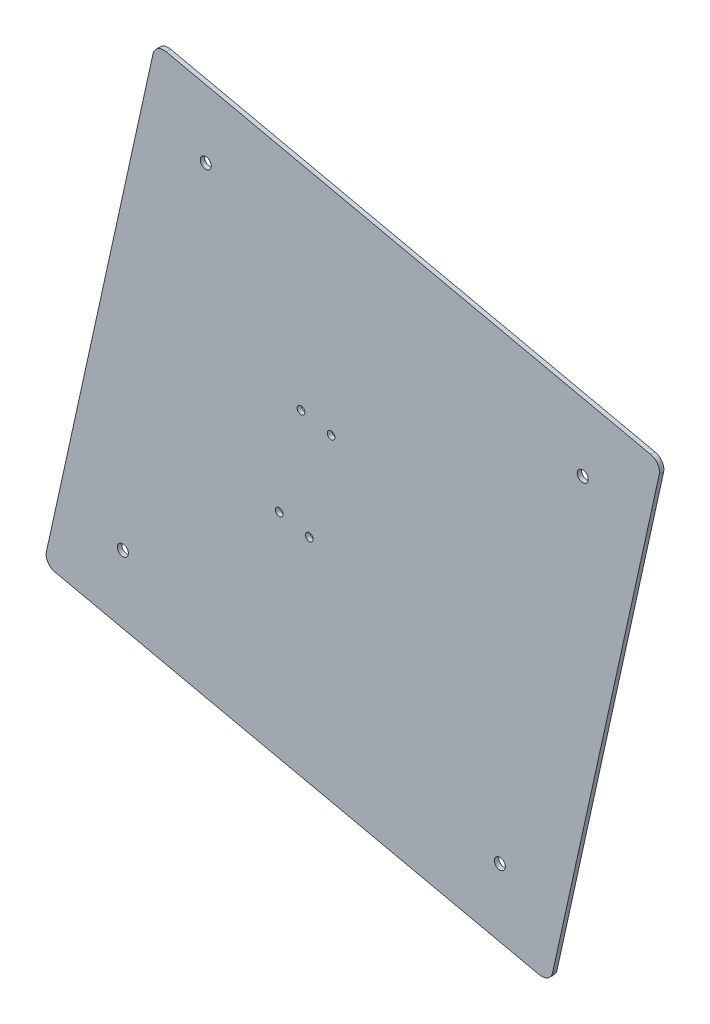
from build123d import *

# Parameters (mm, degrees)
ESQUISSE1_R        = 2.5
ESQUISSE1_R_2      = 1.75
BOSS_EXTRU_1_DEPTH = 2


with BuildPart() as part:
    # Esquisse1 → Boss.-Extru.1 (new body)
    with BuildSketch(Plane.XY):
        with BuildLine():
            Line((-201.77541219, 13.663200047), (17.971945957, -34.670003728))
            ThreePointArc((17.971945957, -34.670003728), (21.739530729, -33.99920873), (23.929291778, -30.860800298))
            Line((23.929291778, -30.860800298), (72.262495553, 188.88655785))
            ThreePointArc((72.262495553, 188.88655785), (71.591700555, 192.654142622), (68.453292123, 194.843903671))
            Line((68.453292123, 194.843903671), (-151.294066025, 243.177107446))
            ThreePointArc((-151.294066025, 243.177107446), (-155.061650796, 242.506312448), (-157.251411845, 239.367904015))
            Line((-157.251411845, 239.367904015), (-205.584615621, 19.620545868))
            ThreePointArc((-205.584615621, 19.620545868), (-204.913820623, 15.852961096), (-201.77541219, 13.663200047))
        make_face()
        with Locations((-133.322120067, 208.507103718)):
            Circle(ESQUISSE1_R, mode=Mode.SUBTRACT)
        with Locations((-170.914611893, 37.592491825)):
            Circle(ESQUISSE1_R, mode=Mode.SUBTRACT)
        Circle(ESQUISSE1_R, mode=Mode.SUBTRACT)
        with Locations((-100.0322124, 88.043731079)):
            Circle(ESQUISSE1_R_2, mode=Mode.SUBTRACT)
        with Locations((37.592491825, 170.914611893)):
            Circle(ESQUISSE1_R, mode=Mode.SUBTRACT)
        with Locations((-86.359043449, 85.036331733)):
            Circle(ESQUISSE1_R_2, mode=Mode.SUBTRACT)
        with Locations((-76.477588455, 129.962458287)):
            Circle(ESQUISSE1_R_2, mode=Mode.SUBTRACT)
        with Locations((-90.150757406, 132.969857633)):
            Circle(ESQUISSE1_R_2, mode=Mode.SUBTRACT)
    extrude(amount=BOSS_EXTRU_1_DEPTH)


solid = part.part
